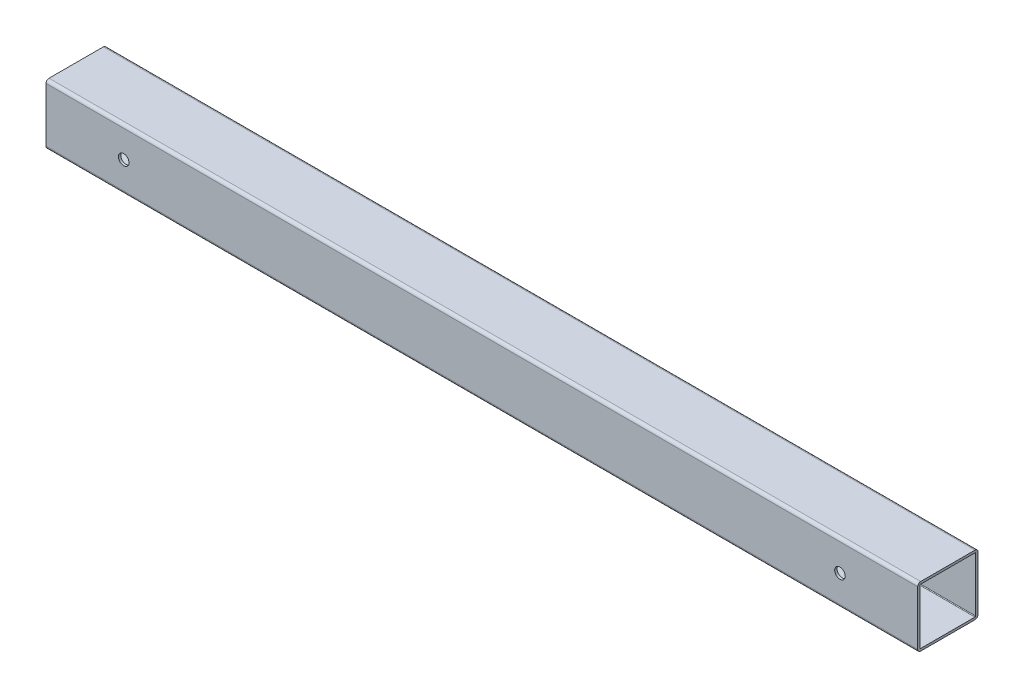
from build123d import *

# Parameters (mm, degrees)
QUADRADO_40_X_40_X_1_55_1_DEPTH = 578.0536
CORTE_EXTRUS_O1_DEPTH           = 293.466222183
CORTE_EXTRUS_O1_DEPTH_BACK      = 293.466222183
ESBO_O4_R                       = 3.5


with BuildPart() as part:
    # Esboço1 → Quadrado 40 X 40 X 1,55(1) (new body)
    with BuildSketch(Plane.YZ.offset(-289.0268)):
        with BuildLine():
            Line((-18, -20), (18, -20))
            ThreePointArc((18, -20), (19.414213562, -19.414213562), (20, -18))
            Line((20, -18), (20, 18))
            ThreePointArc((20, 18), (19.414213562, 19.414213562), (18, 20))
            Line((18, 20), (-18, 20))
            ThreePointArc((-18, 20), (-19.414213562, 19.414213562), (-20, 18))
            Line((-20, 18), (-20, -18))
            ThreePointArc((-20, -18), (-19.414213562, -19.414213562), (-18, -20))
        make_face()
        with BuildLine():
            Line((-18, -18.45), (18, -18.45))
            ThreePointArc((18, -18.45), (18.318198052, -18.318198052), (18.45, -18))
            Line((18.45, -18), (18.45, 18))
            ThreePointArc((18.45, 18), (18.318198052, 18.318198052), (18, 18.45))
            Line((18, 18.45), (-18, 18.45))
            ThreePointArc((-18, 18.45), (-18.318198052, 18.318198052), (-18.45, 18))
            Line((-18.45, 18), (-18.45, -18))
            ThreePointArc((-18.45, -18), (-18.318198052, -18.318198052), (-18, -18.45))
        make_face(mode=Mode.SUBTRACT)
    extrude(amount=QUADRADO_40_X_40_X_1_55_1_DEPTH)

    # Esboço4 → Corte-extrusão1 (cut, two sides: drawn at the far end of the back side and taken through both)
    with BuildSketch(Plane(origin=(0, 0, -20), x_dir=(-1, 0, 0), z_dir=(0, 0, -1)).offset(-CORTE_EXTRUS_O1_DEPTH_BACK)):
        with Locations(Location((-237.5, 0, 0), (0, 0, 270))):
            Circle(ESBO_O4_R)
        with Locations(Location((237.5, 0, 0), (0, 0, 270))):
            Circle(ESBO_O4_R)
    extrude(amount=CORTE_EXTRUS_O1_DEPTH + CORTE_EXTRUS_O1_DEPTH_BACK, mode=Mode.SUBTRACT)


solid = part.part
